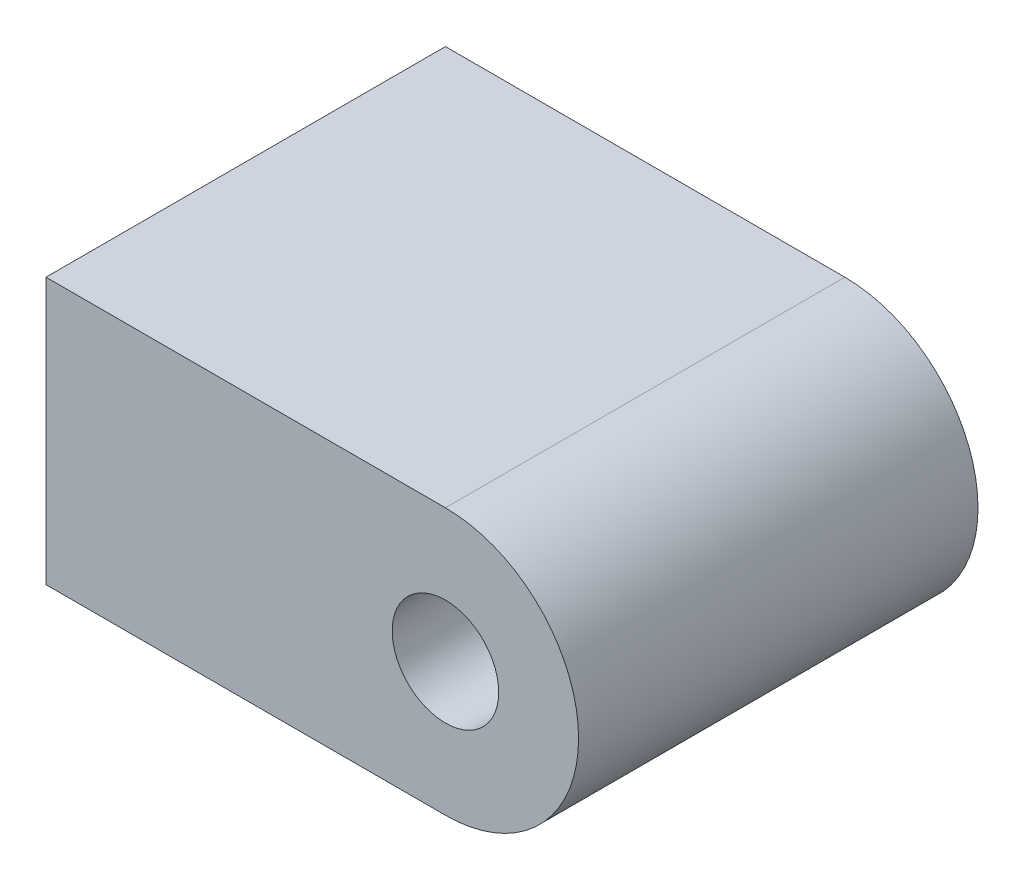
from build123d import *

# Parameters (mm, degrees)
BOSS_EXTRUDE1_DEPTH = 150
SKETCH2_R           = 20
CUT_EXTRUDE1_DEPTH  = 150


with BuildPart() as part:
    # Sketch1 → Boss-Extrude1 (new body)
    with BuildSketch(Plane.XY):
        with BuildLine():
            Line((0, 0), (150, 0))
            ThreePointArc((150, 0), (200, 50), (150, 100))
            Line((150, 100), (0, 100))
            Line((0, 100), (0, 0))
        make_face()
    extrude(amount=BOSS_EXTRUDE1_DEPTH)

    # Sketch2 → Cut-Extrude1 (cut)
    with BuildSketch(Plane.XY.offset(150)):
        with Locations((150, 50)):
            Circle(SKETCH2_R)
    extrude(amount=-CUT_EXTRUDE1_DEPTH, mode=Mode.SUBTRACT)


solid = part.part
